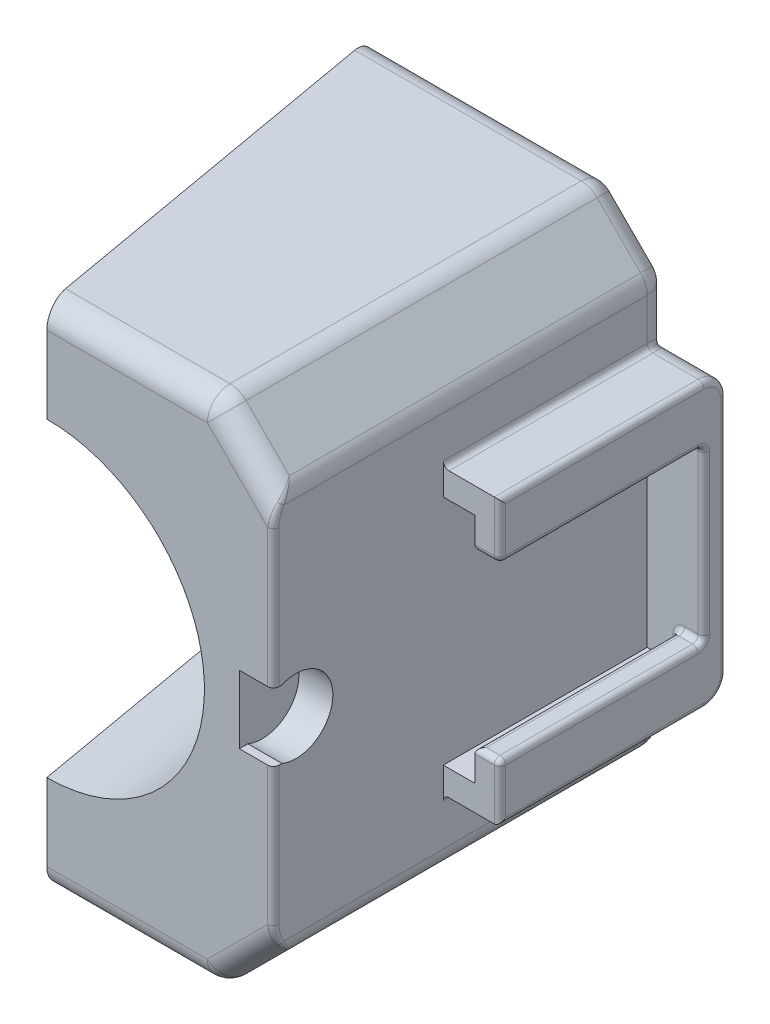
from build123d import *

# Parameters (mm, degrees)
BOSS_EXTRUDE1_DEPTH     = 45
CUT_EXTRUDE1_DEPTH      = 66.041883154
CUT_EXTRUDE1_DEPTH_BACK = 66.041883154
SKETCH2_R               = 13.7
CUT_EXTRUDE2_DEPTH      = 65.974294466
SKETCH4_W               = 5
SKETCH4_H               = 25
CUT_EXTRUDE3_DEPTH      = 15
CUT_EXTRUDE4_DEPTH      = 18
CUT_EXTRUDE5_DEPTH      = 3
SKETCH8_R               = 2.1
CUT_EXTRUDE6_DEPTH      = 15
FILLET1_R               = 2
FILLET2_R               = 0.5


with BuildPart() as part:
    # Sketch1 → Boss-Extrude1 (new body)
    with BuildSketch(Plane(origin=(0, 0, 0), x_dir=(1, 0, 0), z_dir=(0, 1, 0))):
        Polygon((0, 0), (-31.171444325, 0), (-25, -35), (0, -35), align=None)
    extrude(amount=BOSS_EXTRUDE1_DEPTH)

    # Sketch2 → Cut-Extrude1 (cut, two sides: drawn at the far end of the back side and taken through both)
    with BuildSketch(Plane(origin=(5.231510268, 0, 29.669369072), x_dir=(-0.9848077530122074, 0, 0.17364817766693474), z_dir=(-0.17364817766693474, 0, -0.9848077530122074)).offset(-CUT_EXTRUDE1_DEPTH_BACK)):
        with Locations((30.697880044, 22.5)):
            Circle(SKETCH2_R)
    extrude(amount=CUT_EXTRUDE1_DEPTH + CUT_EXTRUDE1_DEPTH_BACK, mode=Mode.SUBTRACT)

    # Sketch3 → Cut-Extrude2 (cut, through all)
    with BuildSketch(Plane.XY.offset(35)):
        Polygon((-5, 35), (-5, 40), (-10, 45), (0, 45), (0, 35), align=None)
        Polygon((-5, 10), (0, 10), (0, 0), (-10, 0), (-5, 5), align=None)
    extrude(amount=-CUT_EXTRUDE2_DEPTH, mode=Mode.SUBTRACT)

    # Sketch4 → Cut-Extrude3 (cut)
    with BuildSketch(Plane.XY.offset(35)):
        with Locations((-2.5, 22.5)):
            Rectangle(SKETCH4_W, SKETCH4_H)
    extrude(amount=-CUT_EXTRUDE3_DEPTH, mode=Mode.SUBTRACT)

    # Sketch5 → Cut-Extrude4 (cut)
    with BuildSketch(Plane.XY.offset(20)):
        Polygon((-5, 32.75), (-2.2, 32.75), (-2.2, 30), (0, 30), (0, 15), (-2.2, 15), (-2.2, 12.25), (-5, 12.25), align=None)
    extrude(amount=-CUT_EXTRUDE4_DEPTH, mode=Mode.SUBTRACT)

    # Sketch6 → Cut-Extrude5 (cut)
    with BuildSketch(Plane(origin=(-5, 0, 0), x_dir=(0, 0, -1), z_dir=(1, 0, 0))):
        with BuildLine():
            Line((-35, 19.5), (-35, 25.5))
            Line((-35, 25.5), (-34.25, 25.5))
            ThreePointArc((-34.25, 25.5), (-29.75, 22.5), (-34.25, 19.5))
            Line((-34.25, 19.5), (-35, 19.5))
        make_face()
    extrude(amount=-CUT_EXTRUDE5_DEPTH, mode=Mode.SUBTRACT)

    # Sketch8 → Cut-Extrude6 (cut)
    with BuildSketch(Plane(origin=(-30.231510268, 0, 5.330630928), x_dir=(0.17364817766693477, 0, 0.9848077530122074), z_dir=(-0.9848077530122072, 0, 0.17364817766693474))):
        with Locations((2.357101206, 40.2)):
            Circle(SKETCH8_R)
        with Locations((22.357101206, 40.2)):
            Circle(SKETCH8_R)
        with Locations((22.357101206, 4.8)):
            Circle(SKETCH8_R)
        with Locations((2.357101206, 4.8)):
            Circle(SKETCH8_R)
    extrude(amount=-CUT_EXTRUDE6_DEPTH, mode=Mode.SUBTRACT)

    # Fillet1
    fillet1_edges = [part.edges().sort_by_distance(p)[0] for p in [
        (-17.5, 45, 35),
        (-20.585722162, 0, 0),
        (-7.5, 2.5, 0),
        (-10, 0, 17.5),
        (-5, 7.5, 0),
        (-5, 5, 17.5),
        (-2.5, 10, 0),
        (-7.5, 2.5, 35),
        (-20.585722162, 45, 0),
        (-2.5, 35, 0),
        (-5, 37.5, 0),
        (-7.5, 42.5, 0),
        (-5, 40, 17.5),
        (-10, 45, 17.5),
        (-17.5, 0, 35),
        (-7.5, 42.5, 35),
    ]]
    fillet(fillet1_edges, radius=FILLET1_R)

    # Fillet2
    fillet2_edges = [part.edges().sort_by_distance(p)[0] for p in [
        (0, 22.5, 0),
        (0, 10, 11),
        (0, 35, 11),
        (0, 10.585786438, 0.585786438),
        (0, 34.414213562, 0.585786438),
        (-5, 35, 11),
        (-5, 10, 11),
        (-5, 31.335786438, 35),
        (-5, 38.216836977, 34.85841639),
        (-5, 6.783163023, 34.85841639),
        (-5.163269118, 39.963039656, 33.739113334),
        (-5.707902185, 34.292097815, 0.473407966),
        (-5.163269118, 5.036960344, 33.739113334),
        (-5.707902185, 10.707902185, 0.473407966),
        (0, 12.5, 20),
        (0, 32.5, 20),
        (-2.2, 30, 11),
        (0, 30, 11),
        (0, 15, 11),
        (-2.2, 15, 11),
        (-1.1, 15, 20),
        (-1.1, 30, 20),
        (-2.2, 31.375, 2),
        (-1.1, 30, 2),
        (0, 22.5, 2),
        (-1.1, 15, 2),
        (-2.2, 13.625, 2),
        (-5, 13.664213562, 35),
    ]]
    fillet(fillet2_edges, radius=FILLET2_R)


solid = part.part
